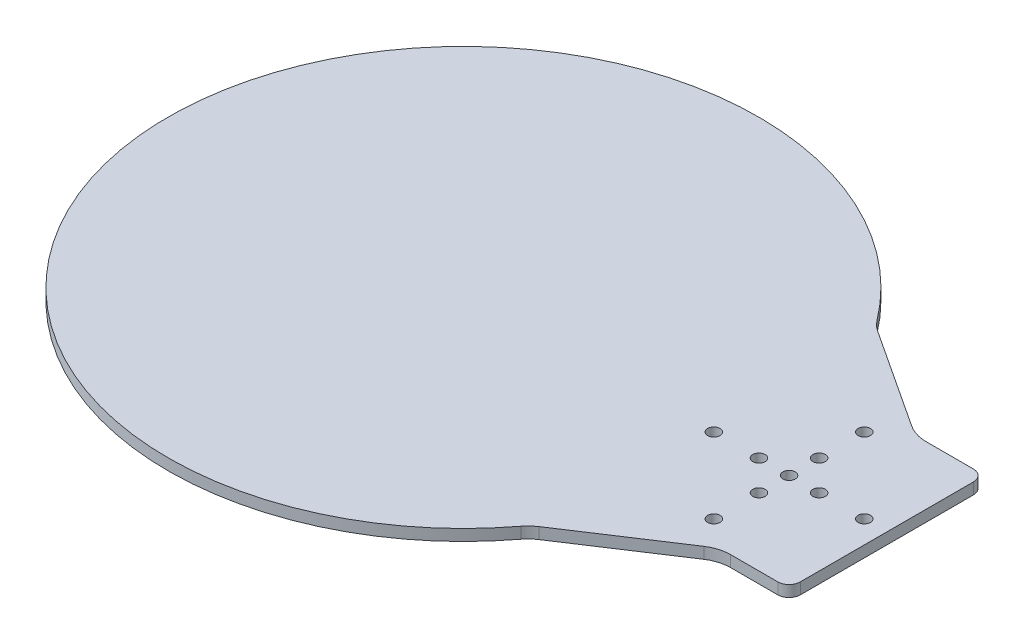
from build123d import *

# Parameters (mm, degrees)
SKETCH1_R           = 1.65
BOSS_EXTRUDE1_DEPTH = 3
BOSS_EXTRUDE2_START = -3
BOSS_EXTRUDE2_DEPTH = 3
FILLET1_R           = 10
FILLET2_R           = 3


with BuildPart() as part:
    # Sketch1 → Boss-Extrude1 (new body)
    with BuildSketch(Plane(origin=(0, 0, 0), x_dir=(1, 0, 0), z_dir=(0, 1, 0))):
        with BuildLine():
            Line((74.069224378, -26), (112.579, -26))
            Line((112.579, -26), (112.579, 26))
            Line((112.579, 26), (74.069224378, 26))
            ThreePointArc((74.069224378, 26), (-78.5, 0), (74.069224378, -26))
        make_face()
        with Locations(Location((86.579, 0, 0), (0, 0, 270))):
            Circle(SKETCH1_R, mode=Mode.SUBTRACT)
        with Locations(Location((94.579, 0, 0), (0, 0, 270))):
            Circle(SKETCH1_R, mode=Mode.SUBTRACT)
        with Locations(Location((106.579, 0, 0), (0, 0, 270))):
            Circle(SKETCH1_R, mode=Mode.SUBTRACT)
        with Locations(Location((86.579, -8, 0), (0, 0, 270))):
            Circle(SKETCH1_R, mode=Mode.SUBTRACT)
        with Locations(Location((86.579, -20, 0), (0, 0, 270))):
            Circle(SKETCH1_R, mode=Mode.SUBTRACT)
        with Locations(Location((78.579, 0, 0), (0, 0, 270))):
            Circle(SKETCH1_R, mode=Mode.SUBTRACT)
        with Locations(Location((66.579, 0, 0), (0, 0, 270))):
            Circle(SKETCH1_R, mode=Mode.SUBTRACT)
        with Locations(Location((86.579, 8, 0), (0, 0, 270))):
            Circle(SKETCH1_R, mode=Mode.SUBTRACT)
        with Locations(Location((86.579, 20, 0), (0, 0, 270))):
            Circle(SKETCH1_R, mode=Mode.SUBTRACT)
    extrude(amount=BOSS_EXTRUDE1_DEPTH)

    # Sketch2 → Boss-Extrude2 (add)
    with BuildSketch(Plane(origin=(0, 3, 0), x_dir=(1, 0, 0), z_dir=(0, 1, 0)).offset(BOSS_EXTRUDE2_START)):
        with BuildLine():
            ThreePointArc((74.069224378, -26), (69.562215981, -36.377851886), (63.610140701, -46))
            Line((63.610140701, -46), (94.069224378, -26))
            Line((94.069224378, -26), (74.069224378, -26))
        make_face()
        with BuildLine():
            Line((74.069224378, 26), (94.069224378, 26))
            Line((94.069224378, 26), (63.610140701, 46))
            ThreePointArc((63.610140701, 46), (69.562215981, 36.377851886), (74.069224378, 26))
        make_face()
    extrude(amount=BOSS_EXTRUDE2_DEPTH)

    # Fillet1
    fillet1_edges = [part.edges().sort_by_distance(p)[0] for p in [
        (63.610140701, 1.5, 46),
        (94.069224378, 1.5, 26),
        (63.610140701, 1.5, -46),
        (94.069224378, 1.5, -26),
    ]]
    fillet(fillet1_edges, radius=FILLET1_R)

    # Fillet2
    fillet2_edges = [part.edges().sort_by_distance(p)[0] for p in [
        (112.579, 1.5, -26),
        (112.579, 1.5, 26),
    ]]
    fillet(fillet2_edges, radius=FILLET2_R)


solid = part.part
